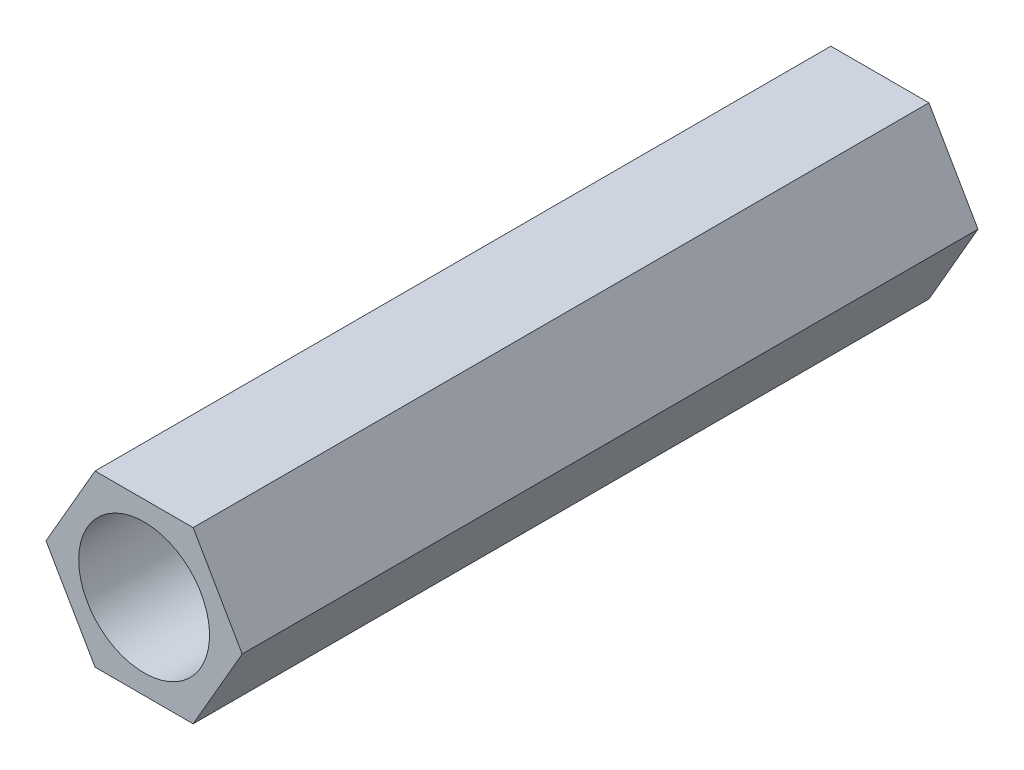
from build123d import *

# Parameters (mm, degrees)
SKETCH_1_R      = 2
EXTRUDE_1_DEPTH = 22.5


with BuildPart() as part:
    # 草图1 → 凸台-拉伸1 (new body)
    with BuildSketch(Plane(origin=(0, 0, 0), x_dir=(-1, 0, 0), z_dir=(0, 0, -1))):
        Polygon((1.5, -2.598076211), (3, 0), (1.5, 2.598076211), (-1.5, 2.598076211), (-3, 0), (-1.5, -2.598076211), align=None)
        Circle(SKETCH_1_R, mode=Mode.SUBTRACT)
    extrude(amount=-EXTRUDE_1_DEPTH)


solid = part.part
